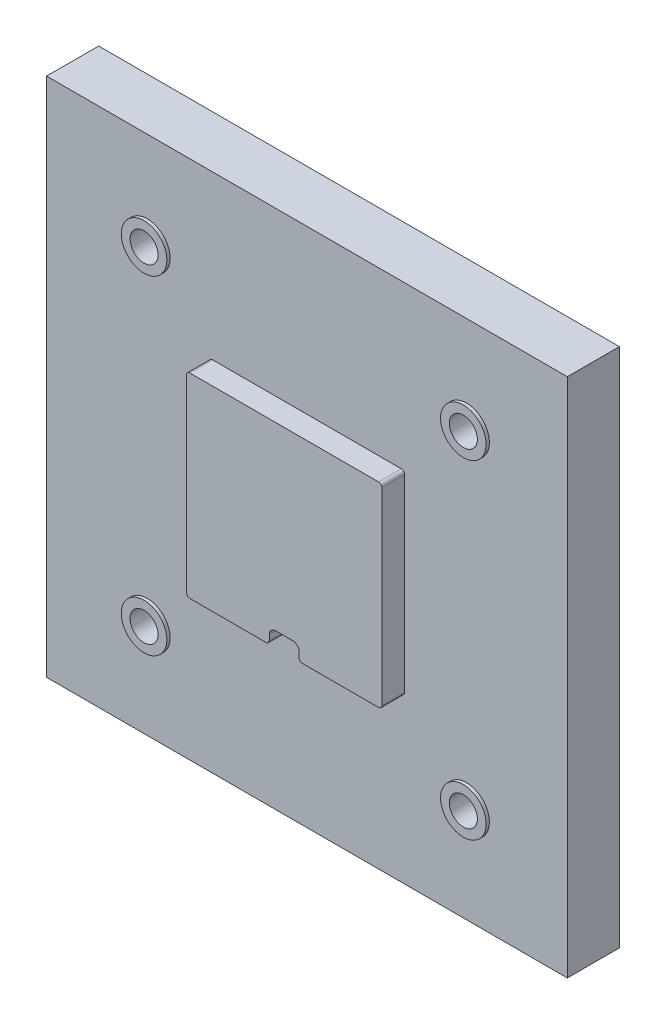
from build123d import *

# Parameters (mm, degrees)
SKETCH1_W         = 30
SKETCH1_H         = 30
EXTRUSION1_DEPTH  = 3.5
SKETCH2_W         = 80
SKETCH2_H         = 80
EXTRUSION2_DEPTH  = 8
EXTRUSION3_DEPTH  = 3.5
FILLET1_R         = 0.5
HOLE2_D           = 4.305
HOLE2_DEPTH       = 8
HOLE2_CBORE_D     = 7.145
HOLE2_CBORE_DEPTH = 4
HOLE2_TIP         = 1.293352482
EXTRUSION4_START  = 0.5
SKETCH6_R         = 3.5
SKETCH6_R_2       = 2.1525
EXTRUSION4_DEPTH  = 0.5


with BuildPart() as part:
    # Sketch1 → Extrusion1 (new body)
    with BuildSketch(Plane.XY):
        Rectangle(SKETCH1_W, SKETCH1_H)
    extrude(amount=EXTRUSION1_DEPTH)

    # Sketch2 → Extrusion2 (add)
    with BuildSketch(Plane(origin=(0, 0, 0), x_dir=(-1, 0, 0), z_dir=(0, 0, -1))):
        Rectangle(SKETCH2_W, SKETCH2_H)
    extrude(amount=EXTRUSION2_DEPTH)

    # Sketch3 → Extrusion3 (cut)
    with BuildSketch(Plane.XY.offset(3.5)):
        with BuildLine():
            Line((-2.292893219, -15), (2.292893219, -15))
            Line((2.292893219, -15), (2.292893219, -13.707106781))
            ThreePointArc((2.292893219, -13.707106781), (2, -13), (1.292893219, -12.707106781))
            Line((1.292893219, -12.707106781), (-1.292893219, -12.707106781))
            ThreePointArc((-1.292893219, -12.707106781), (-2, -13), (-2.292893219, -13.707106781))
            Line((-2.292893219, -13.707106781), (-2.292893219, -15))
        make_face()
    extrude(amount=-EXTRUSION3_DEPTH, mode=Mode.SUBTRACT)

    # Fillet1
    fillet1_edges = [part.edges().sort_by_distance(p)[0] for p in [
        (2.292893219, -15, 1.75),
        (-2.292893219, -15, 1.75),
        (-15, 15, 1.75),
        (15, 15, 1.75),
        (15, -15, 1.75),
        (-15, -15, 1.75),
    ]]
    fillet(fillet1_edges, radius=FILLET1_R)

    # Hole2
    with Locations(Plane(origin=(0, 0, -8), x_dir=(-1, 0, 0), z_dir=(0, 0, -1))):
        with Locations((24.525, -25.25), (24.525, 25.25), (-24.525, 25.25), (-24.525, -25.25)):
            CounterBoreHole(HOLE2_D / 2, HOLE2_CBORE_D / 2, HOLE2_CBORE_DEPTH, depth=HOLE2_DEPTH)
            with Locations((0, 0, -(HOLE2_DEPTH + HOLE2_TIP / 2))):  # 118° drill point
                Cone(0, HOLE2_D / 2, HOLE2_TIP, mode=Mode.SUBTRACT)

    # Sketch6 → Extrusion4 (add)
    # profile 1 of 4: a face of its own
    with BuildSketch(Plane.XY.offset(EXTRUSION4_START)):
        with Locations(Location((-24.525, 25.25, 0), (0, 0, 180))):
            Circle(SKETCH6_R)
        with Locations(Location((-24.525, 25.25, 0), (0, 0, 180))):
            Circle(SKETCH6_R_2, mode=Mode.SUBTRACT)
    # profile 2 of 4: a face of its own
    with BuildSketch(Plane.XY.offset(EXTRUSION4_START)):
        with Locations(Location((24.525, 25.25, 0), (0, 0, 180))):
            Circle(SKETCH6_R)
        with Locations(Location((24.525, 25.25, 0), (0, 0, 180))):
            Circle(SKETCH6_R_2, mode=Mode.SUBTRACT)
    # profile 3 of 4: a face of its own
    with BuildSketch(Plane.XY.offset(EXTRUSION4_START)):
        with Locations(Location((-24.525, -25.25, 0), (0, 0, 180))):
            Circle(SKETCH6_R)
        with Locations(Location((-24.525, -25.25, 0), (0, 0, 180))):
            Circle(SKETCH6_R_2, mode=Mode.SUBTRACT)
    # profile 4 of 4: a face of its own
    with BuildSketch(Plane.XY.offset(EXTRUSION4_START)):
        with Locations(Location((24.525, -25.25, 0), (0, 0, 180))):
            Circle(SKETCH6_R)
        with Locations(Location((24.525, -25.25, 0), (0, 0, 180))):
            Circle(SKETCH6_R_2, mode=Mode.SUBTRACT)
    extrude(amount=-EXTRUSION4_DEPTH)


solid = part.part
